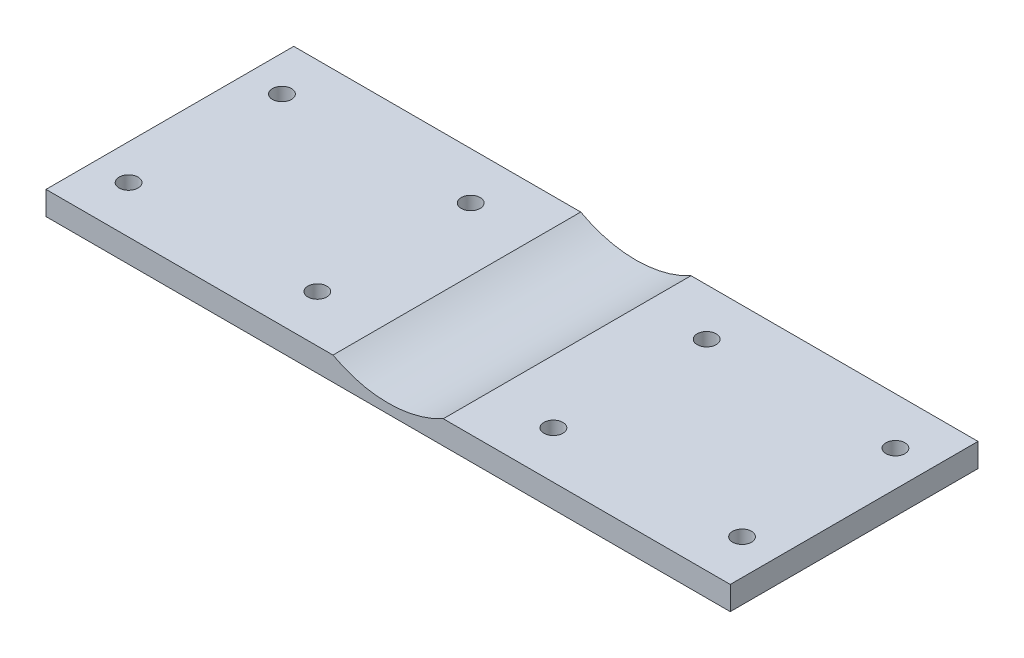
from build123d import *
from build123d.topology import SkipClean

# Parameters (mm, degrees)
SKETCH1_W              = 184.15
SKETCH1_H              = 66.675
BOSS_EXTRUDE1_DEPTH    = 10.541
SKETCH4_W              = 76.2
SKETCH4_H              = 6.35
BOSS_EXTRUDE2_DEPTH    = 66.675
SKETCH5_W              = 53.975
SKETCH5_H              = 66.675
CUT_EXTRUDE1_DEPTH     = 9.525
SKETCH17_W             = 53.975
SKETCH17_H             = 6.35
BOSS_EXTRUDE3_DEPTH    = 66.675
F_10_CLEARANCE_HOLE1_D = 5.1054
SKETCH12_R             = 31.019294643
CUT_EXTRUDE3_DEPTH     = 197.132329834
SKETCH18_W             = 53.975
SKETCH18_H             = 6.35
BOSS_EXTRUDE4_DEPTH    = 66.675
SKETCH20_W             = 53.975
SKETCH20_H             = 1.016
CUT_EXTRUDE8_DEPTH     = 197.132329834
SKETCH21_R             = 2.5527
CUT_EXTRUDE9_DEPTH     = 197.132329834
SKETCH22_W             = 184.15
SKETCH22_H             = 10.541
CUT_EXTRUDE10_DEPTH    = 197.132329834


with BuildPart() as part:
    # Sketch1 → Boss-Extrude1 (new body)
    with BuildSketch(Plane(origin=(0, 0, 0), x_dir=(1, 0, 0), z_dir=(0, 1, 0))):
        with Locations((92.075, 33.3375)):
            Rectangle(SKETCH1_W, SKETCH1_H)
    extrude(amount=BOSS_EXTRUDE1_DEPTH)

    # Sketch4 → Boss-Extrude2 (add)
    with BuildSketch(Plane.XY):
        with Locations((92.075, -3.175)):
            Rectangle(SKETCH4_W, SKETCH4_H)
    extrude(amount=-BOSS_EXTRUDE2_DEPTH)

    # Sketch5 → Cut-Extrude1 (cut)
    with BuildSketch(Plane(origin=(0, 10.541, 0), x_dir=(1, 0, 0), z_dir=(0, 1, 0))):
        with Locations((92.075, 33.3375)):
            Rectangle(SKETCH5_W, SKETCH5_H)
    extrude(amount=-CUT_EXTRUDE1_DEPTH, mode=Mode.SUBTRACT)

    # Sketch17 → Boss-Extrude3 (add)
    with BuildSketch(Plane.XY):
        with Locations((157.1625, -3.175)):
            Rectangle(SKETCH17_W, SKETCH17_H)
    extrude(amount=-BOSS_EXTRUDE3_DEPTH)

    # #10 Clearance Hole1 (through all)
    with Locations(Plane(origin=(0, 10.541, 0), x_dir=(1, 0, 0), z_dir=(0, 1, 0))):
        with Locations((9.525, 53.975), (9.525, 12.7), (60.325, 12.7), (60.325, 53.975), (123.825, 53.975), (123.849810746, 12.7), (174.625, 12.7), (174.625, 53.975)):
            Hole(F_10_CLEARANCE_HOLE1_D / 2)

    # Sketch12 → Cut-Extrude3 (cut, through all)
    with BuildSketch(Plane(origin=(0, 0, -66.675), x_dir=(-1, 0, 0), z_dir=(0, 0, -1))):
        with Locations((-92.075, 27.239371317)):
            Circle(SKETCH12_R)
    extrude(amount=-CUT_EXTRUDE3_DEPTH, mode=Mode.SUBTRACT)

    # Sketch18 → Boss-Extrude4 (add)
    with BuildSketch(Plane.XY):
        with Locations((26.9875, -3.175)):
            Rectangle(SKETCH18_W, SKETCH18_H)
    extrude(amount=-BOSS_EXTRUDE4_DEPTH)

    # Sketch20 → Cut-Extrude8 (cut, through all)
    with BuildSketch(Plane.XY):
        with Locations((92.075, 0.508)):
            Rectangle(SKETCH20_W, SKETCH20_H)
    extrude(amount=-CUT_EXTRUDE8_DEPTH, mode=Mode.SUBTRACT)

    # Sketch21 → Cut-Extrude9 (cut, through all)
    with SkipClean():  # the faces are left unmerged after this step: merging them gives an invalid solid
        with BuildSketch(Plane(origin=(0, 0, 0), x_dir=(1, 0, 0), z_dir=(0, 1, 0))):
            with Locations(Location((9.525, 12.7, 0), (0, 0, 270))):
                Circle(SKETCH21_R)
            with Locations(Location((9.525, 53.975, 0), (0, 0, 270))):
                Circle(SKETCH21_R)
        extrude(amount=-CUT_EXTRUDE9_DEPTH, mode=Mode.SUBTRACT)

    # Sketch22 → Cut-Extrude10 (cut, through all)
    with BuildSketch(Plane.XY):
        with Locations((92.075, 5.2705)):
            Rectangle(SKETCH22_W, SKETCH22_H)
    extrude(amount=-CUT_EXTRUDE10_DEPTH, mode=Mode.SUBTRACT)


solid = part.part
